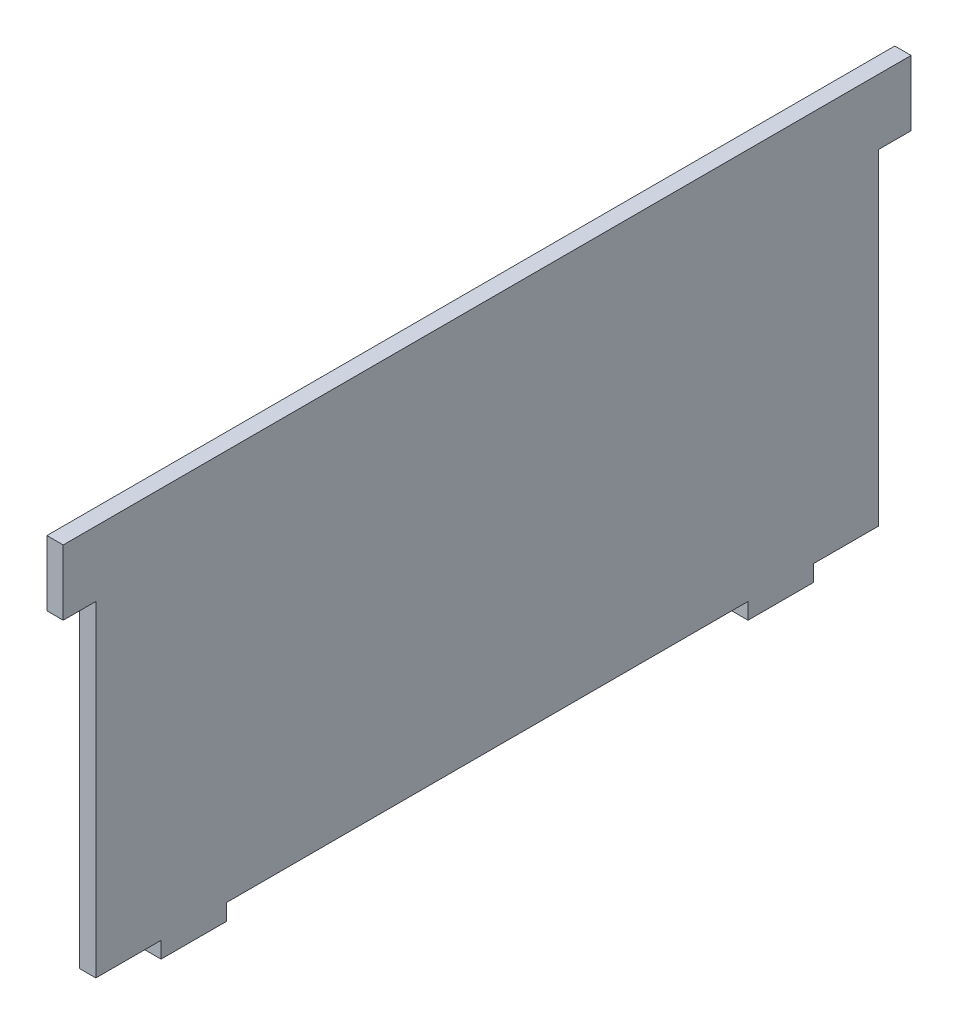
from build123d import *

# Parameters (mm, degrees)
SKIZZE2_W                       = 240
SKIZZE2_H                       = 120
SKIZZE2_W_2                     = 10
SKIZZE2_H_2                     = 20
SKIZZE2_W_3                     = 20
SKIZZE2_H_3                     = 5
AUFSATZ_LINEAR_AUSTRAGEN1_DEPTH = 5


with BuildPart() as part:
    # Skizze2 → Aufsatz-Linear austragen1 (new body)
    with BuildSketch(Plane(origin=(0, 0, 0), x_dir=(0, 0, -1), z_dir=(1, 0, 0))):
        Rectangle(SKIZZE2_W, SKIZZE2_H)
        with Locations((-125, 50)):
            Rectangle(SKIZZE2_W_2, SKIZZE2_H_2)
        with Locations((125, 50)):
            Rectangle(SKIZZE2_W_2, SKIZZE2_H_2)
        with Locations((-90, -62.5)):
            Rectangle(SKIZZE2_W_3, SKIZZE2_H_3)
        with Locations((90, -62.5)):
            Rectangle(SKIZZE2_W_3, SKIZZE2_H_3)
    extrude(amount=AUFSATZ_LINEAR_AUSTRAGEN1_DEPTH)


solid = part.part
